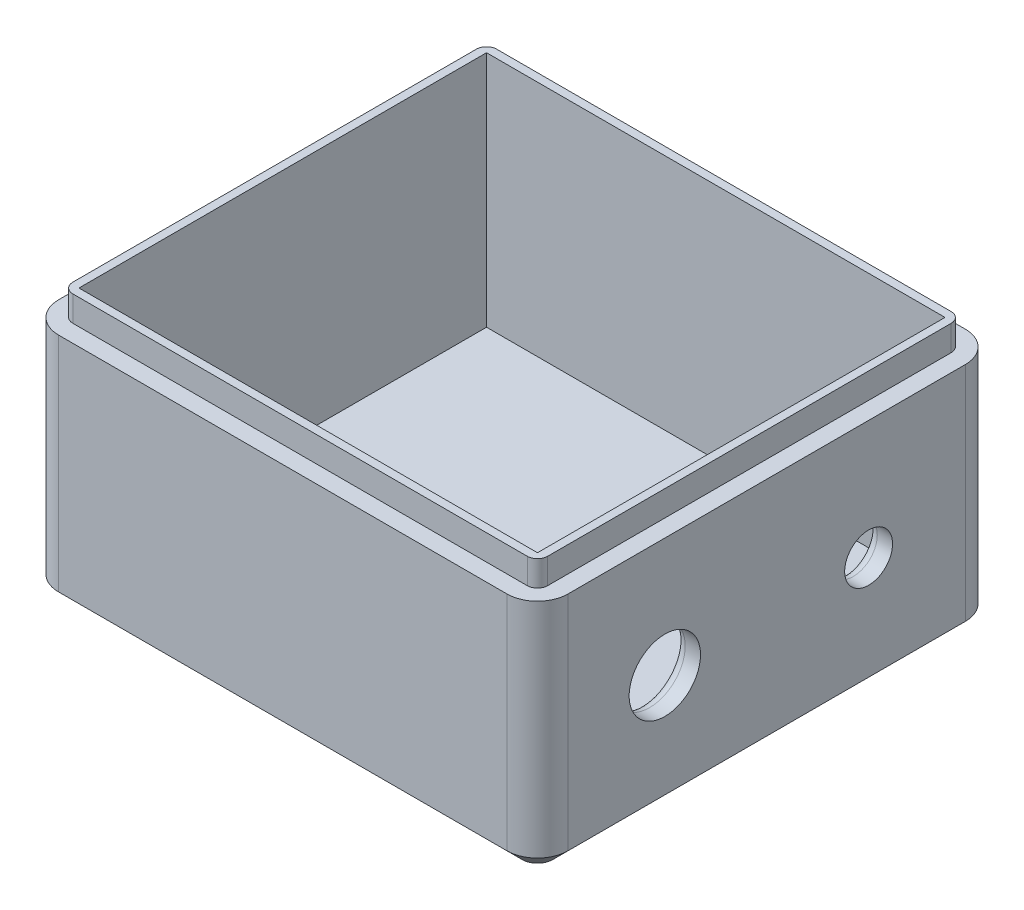
from build123d import *

# Parameters (mm, degrees)
SKETCH1_W           = 50
SKETCH1_H           = 35
BOSS_EXTRUDE1_DEPTH = 45
SKETCH3_W           = 45
SKETCH3_H           = 11.666666667
CUT_EXTRUDE2_DEPTH  = 76.828754441
SHELL1_T            = -2.5
SKETCH2_R           = 3.5
SKETCH2_R_2         = 2.35
CUT_EXTRUDE1_DEPTH  = 4
SKETCH4_W           = 46.6
SKETCH4_H           = 41.6
SKETCH4_W_2         = 45
SKETCH4_H_2         = 40
BOSS_EXTRUDE2_DEPTH = 2.5
FILLET1_R           = 3
FILLET2_R           = 1
CHAMFER1_SIZE       = 1.5
FILLET3_R           = 1


with BuildPart() as part:
    # Sketch1 → Boss-Extrude1 (new body)
    with BuildSketch(Plane.XY):
        with Locations((25, 17.5)):
            Rectangle(SKETCH1_W, SKETCH1_H)
    extrude(amount=BOSS_EXTRUDE1_DEPTH)

    # Sketch3 → Cut-Extrude2 (cut, through all)
    with BuildSketch(Plane(origin=(50, 0, 0), x_dir=(0, 0, -1), z_dir=(1, 0, 0))):
        with Locations((-22.5, 29.166666666)):
            Rectangle(SKETCH3_W, SKETCH3_H)
    extrude(amount=-CUT_EXTRUDE2_DEPTH, mode=Mode.SUBTRACT)

    # Shell1
    shell1_openings = [part.faces().sort_by_distance(p)[0] for p in [
        (25, 23.333333333, 22.5),
    ]]
    offset(amount=SHELL1_T, openings=shell1_openings, kind=Kind.INTERSECTION)

    # Sketch2 → Cut-Extrude1 (cut)
    with BuildSketch(Plane(origin=(50, 0, 0), x_dir=(0, 0, -1), z_dir=(1, 0, 0))):
        with Locations((-32.5, 11.666666667)):
            Circle(SKETCH2_R)
        with Locations((-12.5, 11.666666667)):
            Circle(SKETCH2_R_2)
    extrude(amount=-CUT_EXTRUDE1_DEPTH, mode=Mode.SUBTRACT)

    # Sketch4 → Boss-Extrude2 (add)
    with BuildSketch(Plane(origin=(0, 23.333333333, 0), x_dir=(1, 0, 0), z_dir=(0, 1, 0))):
        with Locations((25, -22.5)):
            Rectangle(SKETCH4_W, SKETCH4_H)
        with Locations((25, -22.5)):
            Rectangle(SKETCH4_W_2, SKETCH4_H_2, mode=Mode.SUBTRACT)
    extrude(amount=BOSS_EXTRUDE2_DEPTH)

    # Fillet1
    fillet1_edges = [part.edges().sort_by_distance(p)[0] for p in [
        (50, 11.666666667, 45),
        (0, 11.666666667, 0),
        (0, 11.666666667, 45),
        (50, 11.666666667, 0),
    ]]
    fillet(fillet1_edges, radius=FILLET1_R)

    # Fillet2
    fillet2_edges = [part.edges().sort_by_distance(p)[0] for p in [
        (1.7, 24.583333333, 1.7),
        (1.7, 24.583333333, 43.3),
        (48.3, 24.583333333, 43.3),
        (48.3, 24.583333333, 1.7),
    ]]
    fillet(fillet2_edges, radius=FILLET2_R)

    # Chamfer1
    chamfer1_edges = [part.edges().sort_by_distance(p)[0] for p in [
        (49.121320344, 0, 0.878679656),
        (0.878679656, 0, 0.878679656),
        (0, 0, 22.5),
        (25, 0, 0),
        (50, 0, 22.5),
        (25, 0, 45),
        (0.878679656, 0, 44.121320344),
        (49.121320344, 0, 44.121320344),
    ]]
    chamfer(chamfer1_edges, length=CHAMFER1_SIZE)

    # Fillet3
    fillet3_edges = [part.edges().sort_by_distance(p)[0] for p in [
        (47.5, 11.666666667, 36),
        (47.5, 11.666666667, 14.85),
    ]]
    fillet(fillet3_edges, radius=FILLET3_R)


solid = part.part
